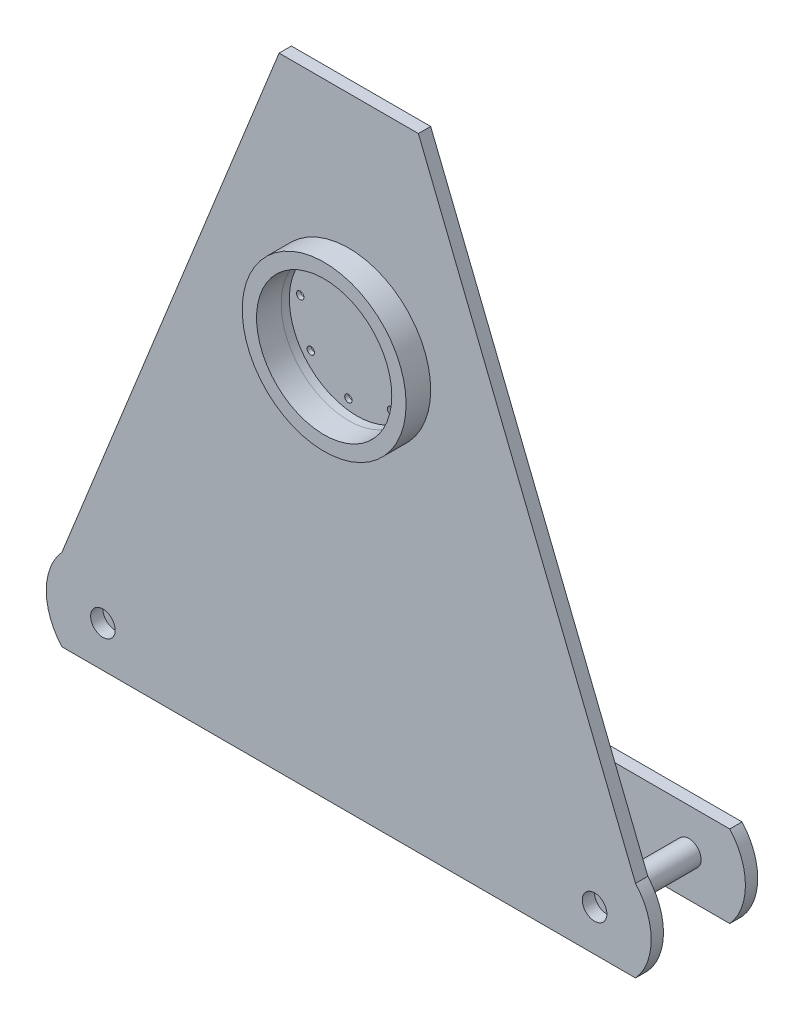
from build123d import *

# Parameters (mm, degrees)
SKETCH1_R             = 15
BOSS_EXTRUDE1_DEPTH   = 15
LPATTERN1_COUNT       = 2
LPATTERN1_PITCH       = 115
SKETCH3_R             = 15
BOSS_EXTRUDE2_DEPTH   = 100
BOSS_EXTRUDE2_2_DEPTH = 100
BOSS_EXTRUDE3_DEPTH   = 15
SKETCH5_R             = 82.5
CUT_EXTRUDE1_DEPTH    = 811.699423633
SKETCH6_R             = 100
BOSS_EXTRUDE4_DEPTH   = 5
SKETCH7_R             = 100
SKETCH7_R_2           = 82.5
BOSS_EXTRUDE5_DEPTH   = 30
SKETCH9_R             = 4.5
CUT_EXTRUDE2_DEPTH    = 810.156076093
CIRPATTERN1_COUNT     = 8


with BuildPart() as part:
    # Sketch1 → Boss-Extrude1 (new body)
    with BuildSketch(Plane.XY):
        with BuildLine():
            Line((-350, -50), (350, -50))
            ThreePointArc((350, -50), (369.098300563, 0), (350, 50))
            Line((350, 50), (-350, 50))
            ThreePointArc((-350, 50), (-369.098300563, 0), (-350, -50))
        make_face()
        with Locations((-300, 0)):
            Circle(SKETCH1_R, mode=Mode.SUBTRACT)
        with Locations((300, 0)):
            Circle(SKETCH1_R, mode=Mode.SUBTRACT)
    extrude(amount=BOSS_EXTRUDE1_DEPTH)


with BuildPart() as lpattern1_1:
    # LPattern1: pattern copy
    add(part.part.moved(Location(Vector(0, 0, 1) * (1 * LPATTERN1_PITCH))))

    # Sketch4 → Boss-Extrude3 (add)
    with BuildSketch(Plane.XY.offset(130)):
        Polygon((-350, 50), (-85, 710), (85, 710), (350, 50), align=None)
    extrude(amount=-BOSS_EXTRUDE3_DEPTH)

    # Sketch5 → Cut-Extrude1 (cut, through all)
    with BuildSketch(Plane.XY.offset(130)):
        with Locations((0, 446.48)):
            Circle(SKETCH5_R)
    extrude(amount=-CUT_EXTRUDE1_DEPTH, mode=Mode.SUBTRACT)

    # Sketch6 → Boss-Extrude4 (add)
    with BuildSketch(Plane.XY.offset(115)):
        with Locations((0, 446.48)):
            Circle(SKETCH6_R)
    extrude(amount=BOSS_EXTRUDE4_DEPTH)

    # Sketch9 → Cut-Extrude2 (cut, through all)
    with BuildSketch(Plane.XY.offset(120)):
        with Locations((-56.310201511, 404.896815829)):
            Circle(SKETCH9_R)
    cut_extrude2 = extrude(amount=-CUT_EXTRUDE2_DEPTH, mode=Mode.SUBTRACT)

    # CirPattern1: Cut-Extrude2 ×8 about axis
    cirpattern1_axis = Axis((0, 446.48, 0), (0, 0, 1))
    for i in range(1, CIRPATTERN1_COUNT):
        add(cut_extrude2.rotate(cirpattern1_axis, i * 360 / CIRPATTERN1_COUNT), mode=Mode.SUBTRACT)


with BuildPart() as body_3:
    # Sketch3 → Boss-Extrude2 (new body)
    with BuildSketch(Plane.XY.offset(15)):
        with Locations((-300, 0)):
            Circle(SKETCH3_R)
    extrude(amount=BOSS_EXTRUDE2_DEPTH)


with BuildPart() as body_4:
    # Sketch3 → Boss-Extrude2 2 (new body)
    with BuildSketch(Plane.XY.offset(15)):
        with Locations((300, 0)):
            Circle(SKETCH3_R)
    extrude(amount=BOSS_EXTRUDE2_2_DEPTH)


with BuildPart() as body_5:
    # Sketch7 → Boss-Extrude5 (new body)
    with BuildSketch(Plane.XY.offset(130)):
        with Locations((0, 446.48)):
            Circle(SKETCH7_R)
        with Locations((0, 446.48)):
            Circle(SKETCH7_R_2, mode=Mode.SUBTRACT)
    extrude(amount=BOSS_EXTRUDE5_DEPTH)


solid = Compound([part.part, lpattern1_1.part, body_3.part, body_4.part, body_5.part])
